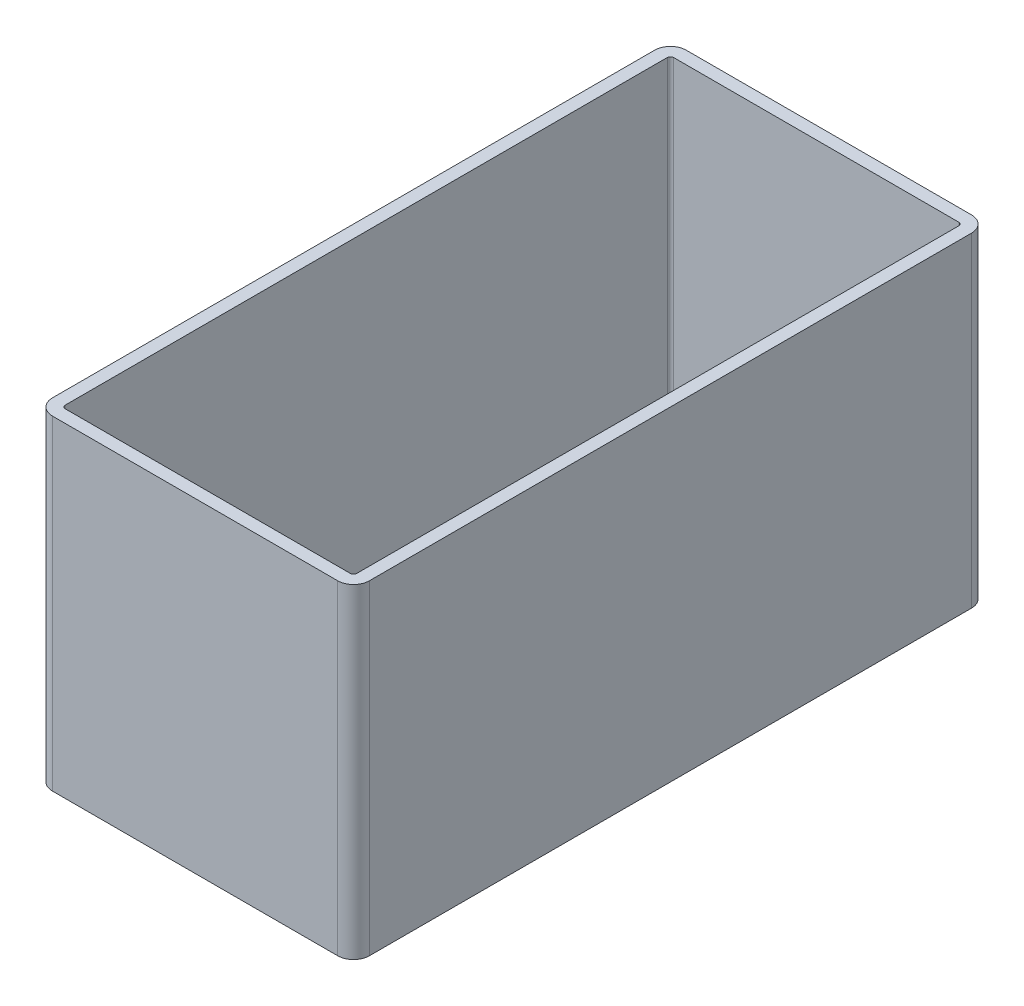
from build123d import *

# Parameters (mm, degrees)
BASES_W            = 20
BASES_H            = 40
BASE_DEPTH         = 10.25
BASE_F_R           = 1
CUT_EXTRUDE3_DEPTH = 31.335622624


with BuildPart() as part:
    # BaseS → BASE (new, symmetric)
    with BuildSketch(Plane(origin=(0, 0, 0), x_dir=(1, 0, 0), z_dir=(0, 1, 0))):
        Rectangle(BASES_W, BASES_H)
    extrude(amount=BASE_DEPTH, both=True)

    # BASE F
    base_f_edges = [part.edges().sort_by_distance(p)[0] for p in [
        (10, 0, 20),
        (-10, 0, 20),
        (-10, 0, -20),
        (10, 0, -20),
    ]]
    fillet(base_f_edges, radius=BASE_F_R)

    # PocketS → Cut-Extrude3 (cut, through all)
    with BuildSketch(Plane(origin=(0, 10.25, 0), x_dir=(1, 0, 0), z_dir=(0, 1, 0))):
        with BuildLine():
            Line((9, 19.2), (-9, 19.2))
            ThreePointArc((-9, 19.2), (-9.141421356, 19.141421356), (-9.2, 19))
            Line((-9.2, 19), (-9.2, -19))
            ThreePointArc((-9.2, -19), (-9.141421356, -19.141421356), (-9, -19.2))
            Line((-9, -19.2), (9, -19.2))
            ThreePointArc((9, -19.2), (9.141421356, -19.141421356), (9.2, -19))
            Line((9.2, -19), (9.2, 19))
            ThreePointArc((9.2, 19), (9.141421356, 19.141421356), (9, 19.2))
        make_face()
    extrude(amount=-CUT_EXTRUDE3_DEPTH, mode=Mode.SUBTRACT)


solid = part.part
